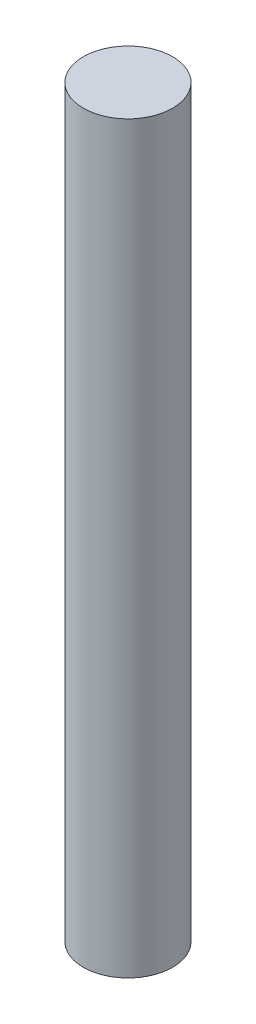
from build123d import *

# Parameters (mm, degrees)
SK_STAINLESS_SHEATH_R  = 3
STAINLESS_SHEATH_DEPTH = 50


with BuildPart() as part:
    # SK Stainless sheath → Stainless sheath (new body)
    with BuildSketch(Plane(origin=(0, 0, 0), x_dir=(1, 0, 0), z_dir=(0, 1, 0))):
        Circle(SK_STAINLESS_SHEATH_R)
    extrude(amount=STAINLESS_SHEATH_DEPTH)


solid = part.part
